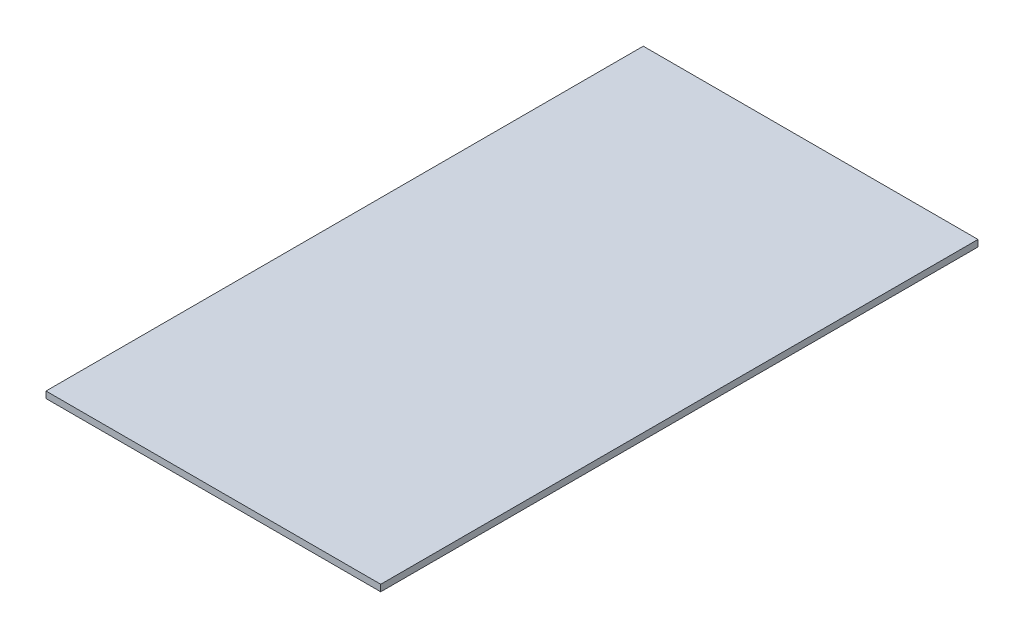
from build123d import *

# Parameters (mm, degrees)
SKETCH2_W           = 255
SKETCH2_H           = 455
BOSS_EXTRUDE1_DEPTH = 5


with BuildPart() as part:
    # Sketch2 → Boss-Extrude1 (new body)
    with BuildSketch(Plane(origin=(0, 385.86186402, 0), x_dir=(1, 0, 0), z_dir=(0, 1, 0))):
        with Locations((79.332776424, 220.815039757)):
            Rectangle(SKETCH2_W, SKETCH2_H)
    extrude(amount=-BOSS_EXTRUDE1_DEPTH)


solid = part.part
